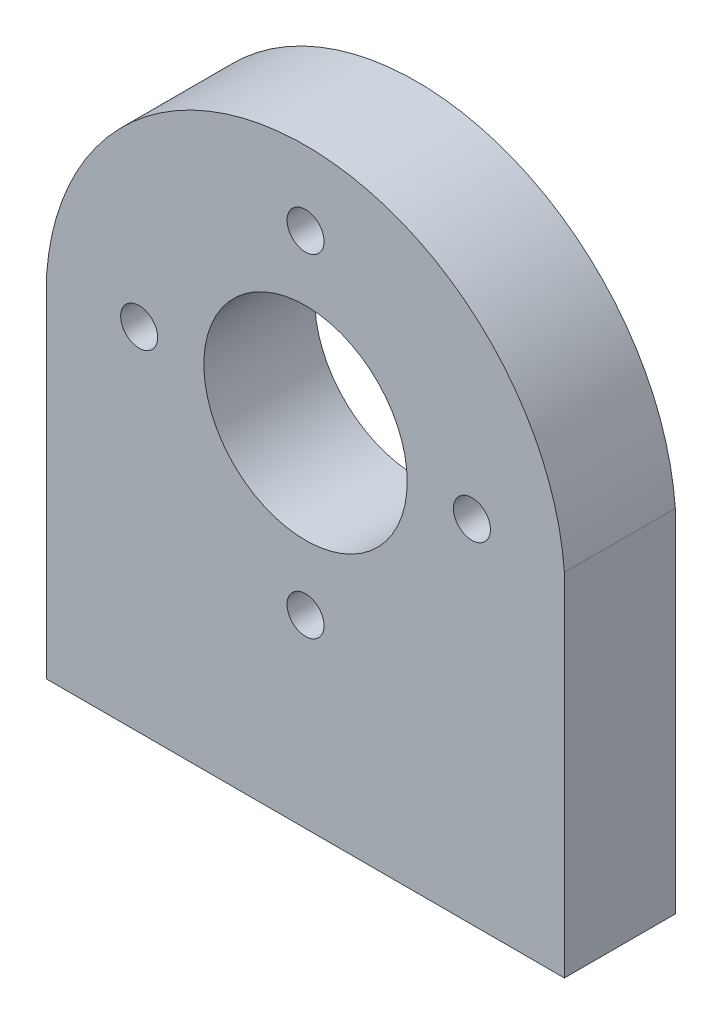
from build123d import *

# Parameters (mm, degrees)
ESQUISSE1_W             = 28
ESQUISSE1_H             = 32
BOSS_EXTRU_1_DEPTH      = 6
ESQUISSE2_R             = 1.25
ENL_V_MAT_EXTRU_1_DEPTH = 10
ESQUISSE3_R             = 5.5
ENL_V_MAT_EXTRU_2_DEPTH = 43.941821107
ESQUISSE4_R             = 1
ENL_V_MAT_EXTRU_4_DEPTH = 43.941821107
ENL_V_MAT_EXTRU_5_DEPTH = 43.941821107


with BuildPart() as part:
    # Esquisse1 → Boss.-Extru.1 (new body)
    with BuildSketch(Plane.XY):
        with Locations((14, 16)):
            Rectangle(ESQUISSE1_W, ESQUISSE1_H)
    extrude(amount=BOSS_EXTRU_1_DEPTH)

    # Esquisse2 → Enlèv. mat.-Extru.1 (cut)
    with BuildSketch(Plane.XZ):
        with Locations(Location((6, 3, 0), (0, 0, 270))):
            Circle(ESQUISSE2_R)
        with Locations(Location((22, 3, 0), (0, 0, 90))):
            Circle(ESQUISSE2_R)
    extrude(amount=-ENL_V_MAT_EXTRU_1_DEPTH, mode=Mode.SUBTRACT)

    # Esquisse3 → Enlèv. mat.-Extru.2 (cut, through all)
    with BuildSketch(Plane.XY.offset(6)):
        with Locations((14, 19)):
            Circle(ESQUISSE3_R)
    extrude(amount=-ENL_V_MAT_EXTRU_2_DEPTH, mode=Mode.SUBTRACT)

    # Esquisse4 → Enlèv. mat.-Extru.4 (cut, through all)
    with BuildSketch(Plane.XY.offset(6)):
        with Locations((14, 10)):
            Circle(ESQUISSE4_R)
        with Locations((5, 19)):
            Circle(ESQUISSE4_R)
        with Locations((14, 28)):
            Circle(ESQUISSE4_R)
        with Locations((23, 19)):
            Circle(ESQUISSE4_R)
    extrude(amount=-ENL_V_MAT_EXTRU_4_DEPTH, mode=Mode.SUBTRACT)

    # Esquisse5 → Enlèv. mat.-Extru.5 (cut, through all)
    with BuildSketch(Plane.XY.offset(6)):
        with BuildLine():
            Line((0, 19), (0, 33))
            Line((0, 33), (28, 33))
            Line((28, 33), (28, 19))
            ThreePointArc((28, 19), (14, 32), (0, 19))
        make_face()
    extrude(amount=-ENL_V_MAT_EXTRU_5_DEPTH, mode=Mode.SUBTRACT)


solid = part.part
